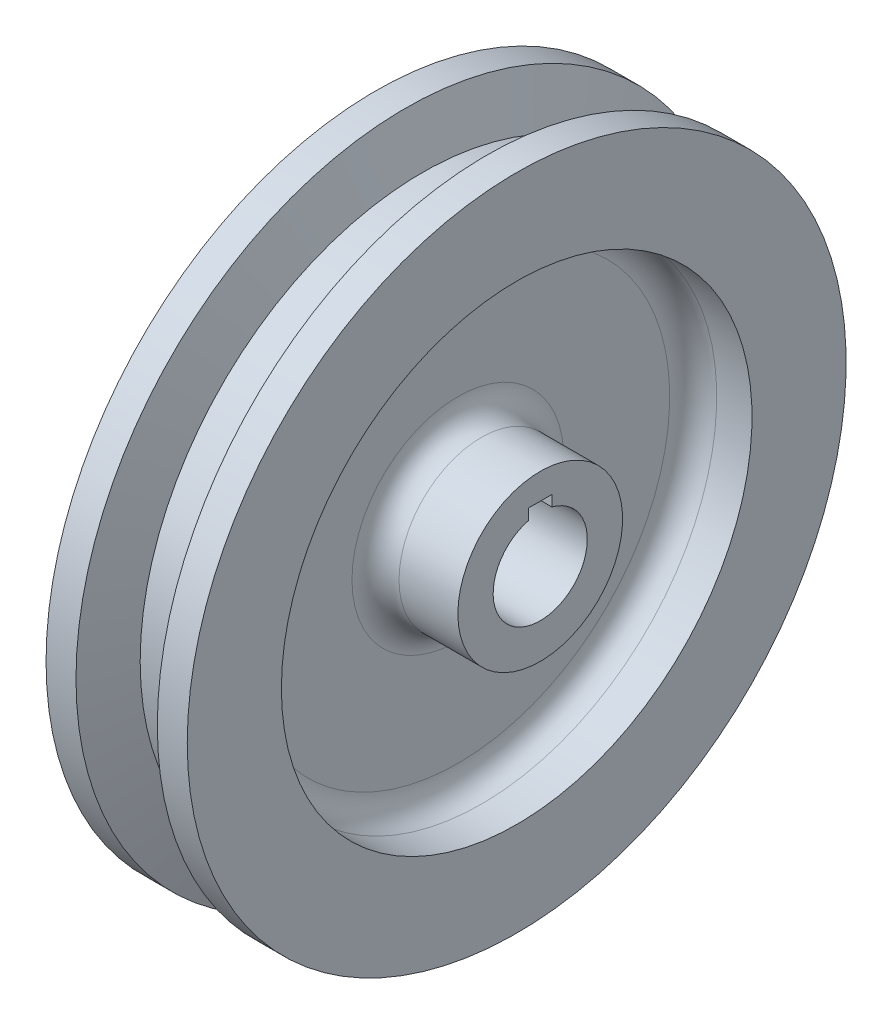
from build123d import *

# Parameters (mm, degrees)
CUT_EXTRUDE1_DEPTH      = 138.371503595
CUT_EXTRUDE1_DEPTH_BACK = 138.371503595
SKETCH2_W               = 6.35
SKETCH2_H               = 2.943277876


with BuildPart() as part:
    # Sketch1 → Revolve1 (revolve)
    with BuildSketch(Plane.XY, mode=Mode.PRIVATE) as revolve1_sk:
        with BuildLine():
            Line((-25.4, 0), (25.4, 0))
            Line((25.4, 0), (25.4, 9.525))
            Line((25.4, 9.525), (9.525, 9.525))
            ThreePointArc((9.525, 9.525), (5.034871939, 11.384871939), (3.175, 15.875))
            Line((3.175, 15.875), (3.175, 44.45))
            ThreePointArc((3.175, 44.45), (5.034871939, 48.940128061), (9.525, 50.8))
            Line((9.525, 50.8), (19.05, 50.8))
            Line((19.05, 50.8), (19.05, 76.2))
            Line((19.05, 76.2), (10.972421975, 76.2))
            Line((10.972421975, 76.2), (6.35, 63.5))
            Line((6.35, 63.5), (-6.35, 63.5))
            Line((-6.35, 63.5), (-10.972421975, 76.2))
            Line((-10.972421975, 76.2), (-19.05, 76.2))
            Line((-19.05, 76.2), (-19.05, 50.8))
            Line((-19.05, 50.8), (-9.525, 50.8))
            ThreePointArc((-9.525, 50.8), (-5.034871939, 48.940128061), (-3.175, 44.45))
            Line((-3.175, 44.45), (-3.175, 15.875))
            ThreePointArc((-3.175, 15.875), (-5.034871939, 11.384871939), (-9.525, 9.525))
            Line((-9.525, 9.525), (-25.4, 9.525))
            Line((-25.4, 9.525), (-25.4, 0))
        make_face()
    revolve(revolve1_sk.sketch.rotate(Axis((-43.274074074, -12.7, 0), (1, 0, 0)), 90), axis=Axis((-43.274074074, -12.7, 0), (1, 0, 0)))

    # Sketch2 → Cut-Extrude1 (cut, two sides: drawn at the far end of the back side and taken through both)
    with BuildSketch(Plane(origin=(0, 0, 0), x_dir=(0, 0, -1), z_dir=(1, 0, 0)).offset(-CUT_EXTRUDE1_DEPTH_BACK)):
        with Locations((0, 1.068361062)):
            Rectangle(SKETCH2_W, SKETCH2_H)
    extrude(amount=CUT_EXTRUDE1_DEPTH + CUT_EXTRUDE1_DEPTH_BACK, mode=Mode.SUBTRACT)


solid = part.part
